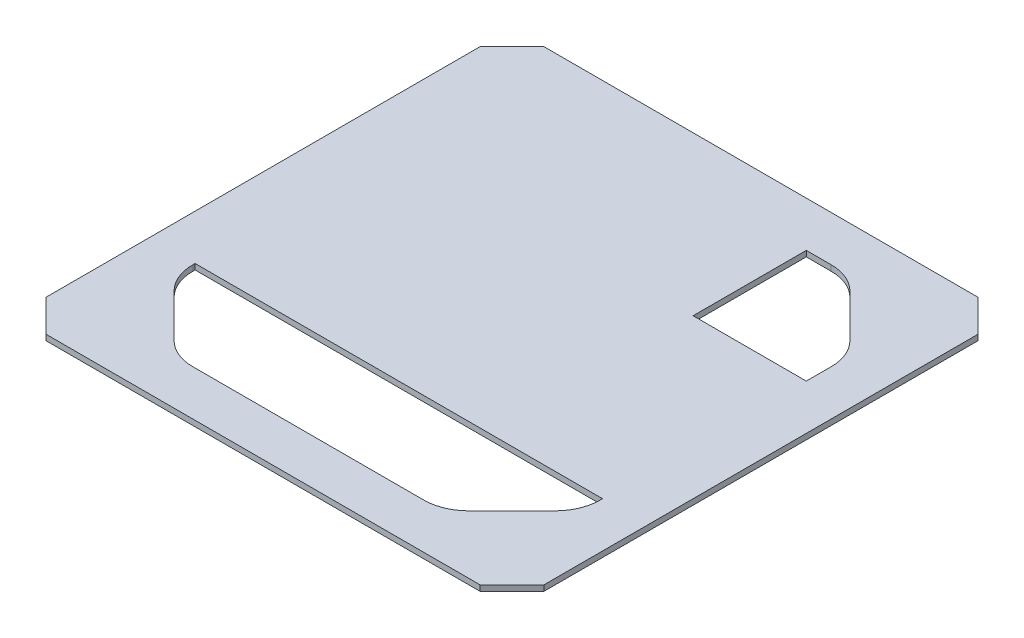
from build123d import *

# Parameters (mm, degrees)
BOSS_EXTRUDE1_DEPTH = 3.175
CUT_EXTRUDE4_DEPTH  = 235.179100055
FILLET1_R           = 25.4
BOSS_EXTRUDE2_DEPTH = 3.175


with BuildPart() as part:
    # Sketch1 → Boss-Extrude1 (new body)
    with BuildSketch(Plane(origin=(0, 0, 0), x_dir=(1, 0, 0), z_dir=(0, 1, 0))):
        Polygon((-139.7, 73.520142619), (-121.739487758, 91.480654861), (121.739487758, 91.480654861), (139.7, 73.520142619), (139.7, -169.958832897), (121.739487758, -187.919345139), (-121.739487758, -187.919345139), (-139.7, -169.958832897), align=None)
    extrude(amount=BOSS_EXTRUDE1_DEPTH)

    # Sketch2 → Cut-Extrude4 (cut, through all)
    with BuildSketch(Plane(origin=(0, 3.175, 0), x_dir=(1, 0, 0), z_dir=(0, 1, 0))):
        Polygon((-103.778975516, 37.599118134), (-114.3, 27.07809365), (-114.3, -123.516783928), (-103.778975516, -134.037808413), (-85.818463274, -151.998320655), (-75.297438789, -162.519345139), (75.297438789, -162.519345139), (85.818463274, -151.998320655), (103.778975516, -134.037808413), (114.3, -123.516783928), (114.3, 27.07809365), (103.778975516, 37.599118134), (85.818463274, 55.559630377), (75.297438789, 66.080654861), (-75.297438789, 66.080654861), (-85.818463274, 55.559630377), align=None)
    extrude(amount=-CUT_EXTRUDE4_DEPTH, mode=Mode.SUBTRACT)

    # Fillet1
    fillet1_edges = [part.edges().sort_by_distance(p)[0] for p in [
        (-75.297438789, 1.5875, -66.080654861),
        (75.297438789, 1.5875, -66.080654861),
        (114.3, 1.5875, -27.07809365),
        (114.3, 1.5875, 123.516783928),
        (75.297438789, 1.5875, 162.519345139),
        (-75.297438789, 1.5875, 162.519345139),
        (-114.3, 1.5875, 123.516783928),
        (-114.3, 1.5875, -27.07809365),
    ]]
    fillet(fillet1_edges, radius=FILLET1_R)

    # Sketch6 → Boss-Extrude2 (add)
    with BuildSketch(Plane(origin=(0, 3.175, 0), x_dir=(1, 0, 0), z_dir=(0, 1, 0))):
        Polygon((50.8, 2.580654861), (139.7, 2.580654861), (139.7, -111.719345139), (-139.7, -111.719345139), (-139.7, 2.580654861), (-139.7, 73.520142619), (50.8, 73.520142619), align=None)
    extrude(amount=-BOSS_EXTRUDE2_DEPTH)


solid = part.part
